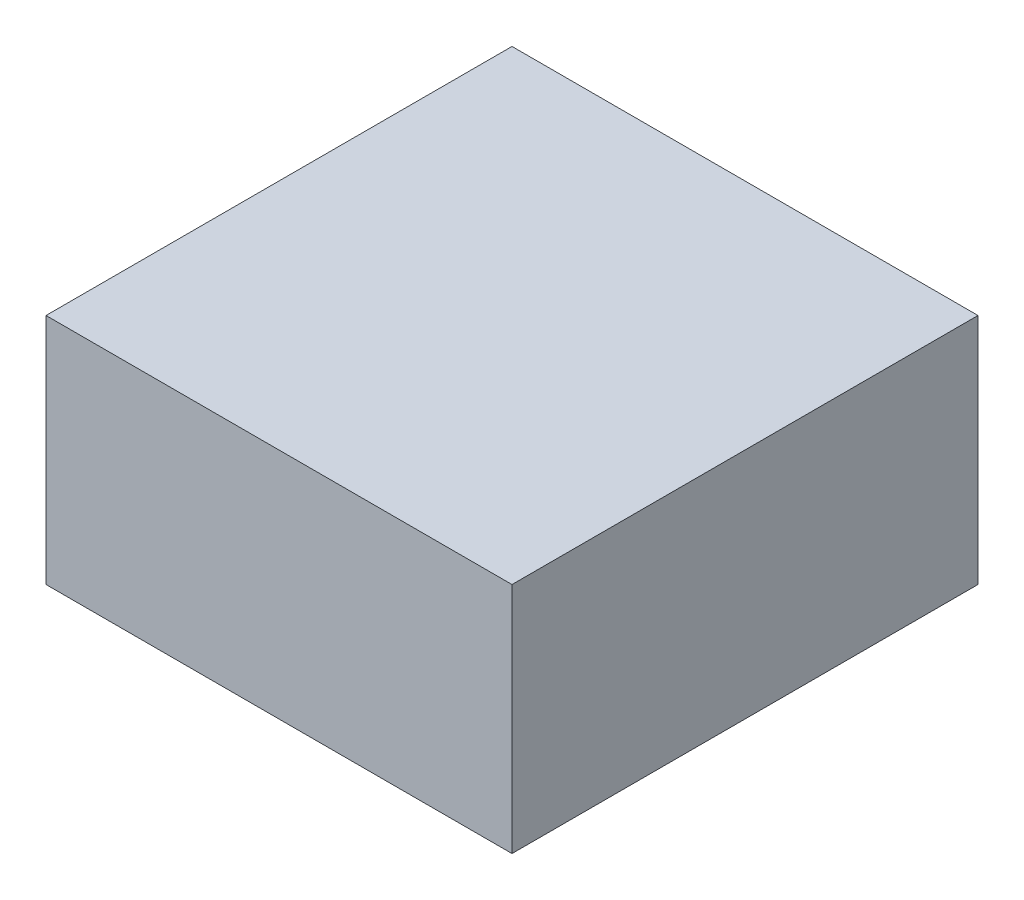
from build123d import *

# Parameters (mm, degrees)
SKETCH1_W           = 40
SKETCH1_H           = 40
BOSS_EXTRUDE1_DEPTH = 20


with BuildPart() as part:
    # Sketch1 → Boss-Extrude1 (new body)
    with BuildSketch(Plane(origin=(0, 0, 0), x_dir=(1, 0, 0), z_dir=(0, 1, 0))):
        with Locations((5.093464217, 5.688883689)):
            Rectangle(SKETCH1_W, SKETCH1_H)
    extrude(amount=BOSS_EXTRUDE1_DEPTH)


solid = part.part
